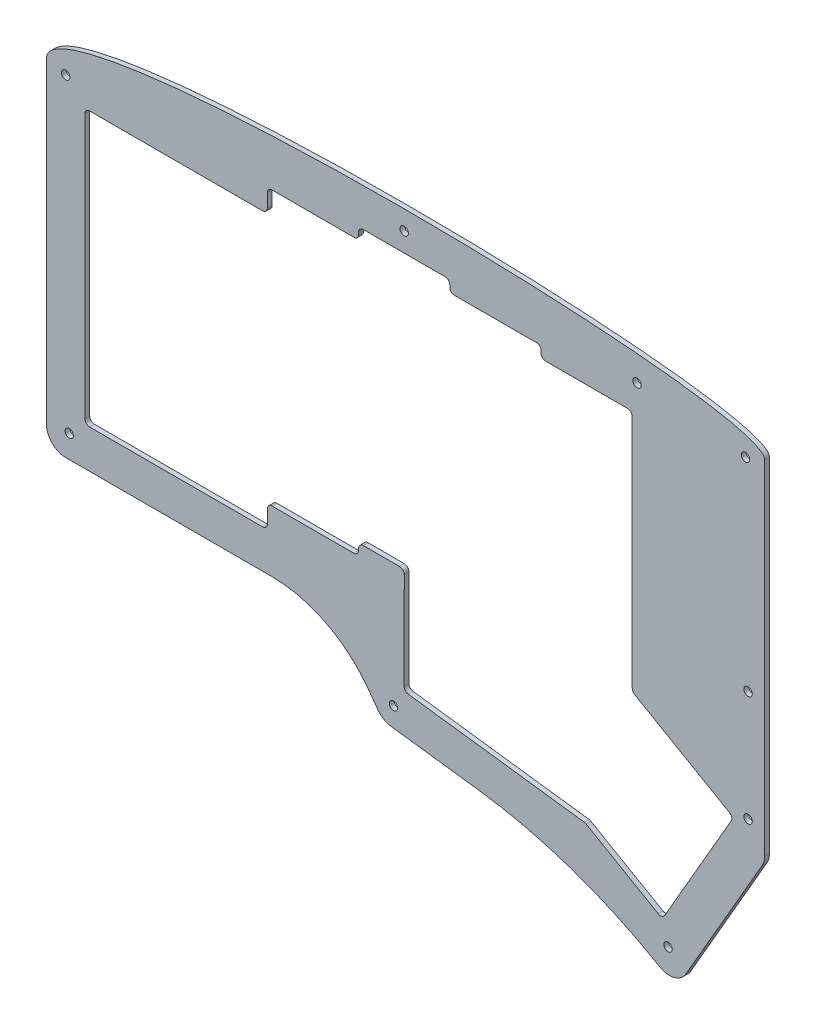
from build123d import *

# Parameters (mm, degrees)
SKETCH2_R           = 0.875
BOSS_EXTRUDE1_DEPTH = 1


with BuildPart() as part:
    # Sketch2 → Boss-Extrude1 (new body)
    with BuildSketch(Plane.XY):
        with BuildLine():
            Line((-5.603408365, 96.42556159), (-5.603408365, 30.425568858))
            ThreePointArc((-5.603408365, 30.425568858), (-4.43183549, 27.597141733), (-1.603408365, 26.425568858))
            Line((-1.603408365, 26.425568858), (41.250894393, 26.425568858))
            ThreePointArc((41.250894393, 26.425568858), (52.580802046, 23.710837368), (61.450097132, 16.156224264))
            Line((61.450097132, 16.156224264), (63.436905361, 13.431841599))
            ThreePointArc((63.436905361, 13.431841599), (64.629324911, 12.347724535), (66.15279536, 11.822165805))
            Line((66.15279536, 11.822165805), (84.159730921, 9.479779923))
            ThreePointArc((84.159730921, 9.479779923), (103.351530482, 5.02611066), (121.297670701, -3.103858071))
            Line((121.297670701, -3.103858071), (122.126093986, -3.582626958))
            ThreePointArc((122.126093986, -3.582626958), (125.162033535, -3.98331921), (127.591695632, -2.119391819))
            Line((127.591695632, -2.119391819), (143.453487011, 25.354036748))
            ThreePointArc((143.453487011, 25.354036748), (143.853088701, 26.318760568), (143.989385396, 27.354036748))
            Line((143.989385396, 27.354036748), (143.989385396, 98.790469349))
            add(Edge.make_bspline(
                [(-5.603408365, 96.42556159), (-5.603408365, 103.460733083), (68.627157279, 109.640132521), (143.989385396, 103.458567417), (143.989385396, 98.790469349)],
                knots=[0, 0, 0, 0, 0.499912399, 1, 1, 1, 1], degree=3))
        make_face()
        with Locations((123.859596668, 0.88165491)):
            Circle(SKETCH2_R, mode=Mode.SUBTRACT)
        with Locations((140.524945013, 32.281066453)):
            Circle(SKETCH2_R, mode=Mode.SUBTRACT)
        with Locations((140.524945013, 55.281066453)):
            Circle(SKETCH2_R, mode=Mode.SUBTRACT)
        with Locations((139.989385396, 97.290469349)):
            Circle(SKETCH2_R, mode=Mode.SUBTRACT)
        with Locations((117.399952063, 99.390469349)):
            Circle(SKETCH2_R, mode=Mode.SUBTRACT)
        with Locations((68.896968427, 102.54989148)):
            Circle(SKETCH2_R, mode=Mode.SUBTRACT)
        with Locations((-1.603408365, 95.42556159)):
            Circle(SKETCH2_R, mode=Mode.SUBTRACT)
        with Locations((-0.871175318, 31.157801905)):
            Circle(SKETCH2_R, mode=Mode.SUBTRACT)
        with Locations((66.6687778, 15.788746464)):
            Circle(SKETCH2_R, mode=Mode.SUBTRACT)
        with BuildLine():
            Line((2.396591635, 90.463437274), (2.396591635, 35.425568858))
            ThreePointArc((2.396591635, 35.425568858), (2.689484854, 34.718462076), (3.396591635, 34.425568858))
            Line((3.396591635, 34.425568858), (39.394762972, 34.425568858))
            ThreePointArc((39.394762972, 34.425568858), (40.101869753, 34.718462076), (40.394762972, 35.425568858))
            Line((40.394762972, 35.425568858), (40.394762972, 38.171054802))
            ThreePointArc((40.394762972, 38.171054802), (40.687656191, 38.878161583), (41.394762972, 39.171054802))
            Line((41.394762972, 39.171054802), (58.395031929, 39.171054802))
            ThreePointArc((58.395031929, 39.171054802), (59.10213871, 39.463948021), (59.395031929, 40.171054802))
            Line((59.395031929, 40.171054802), (59.395031929, 40.549898748))
            ThreePointArc((59.395031929, 40.549898748), (59.687925148, 41.257005529), (60.395031929, 41.549898748))
            Line((60.395031929, 41.549898748), (67.915303846, 41.549898748))
            ThreePointArc((67.915303846, 41.549898748), (68.622863481, 41.256552384), (68.915303025, 40.548617472))
            Line((68.915303025, 40.548617472), (68.889503983, 20.413194101))
            ThreePointArc((68.889503983, 20.413194101), (69.137749853, 19.75246839), (69.760507552, 19.420267661))
            Line((69.760507552, 19.420267661), (106.406539112, 14.653262932))
            ThreePointArc((106.406539112, 14.653262932), (106.598457108, 14.608726239), (106.77791851, 14.527426552))
            Line((106.77791851, 14.527426552), (121.798174914, 5.846802094))
            ThreePointArc((121.798174914, 5.846802094), (122.557159801, 5.746629031), (123.164575325, 6.212610879))
            Line((123.164575325, 6.212610879), (136.560419931, 29.414894346))
            Line((136.560419931, 29.414894346), (136.998243059, 30.153322469))
            ThreePointArc((136.998243059, 30.153322469), (137.105460539, 30.916626107), (136.637925468, 31.529438468))
            Line((136.637925468, 31.529438468), (116.900098761, 42.920620776))
            ThreePointArc((116.900098761, 42.920620776), (116.533969008, 43.286657516), (116.399952063, 43.78673086))
            Line((116.399952063, 43.78673086), (116.399952063, 92.828345033))
            ThreePointArc((116.399952063, 92.828345033), (116.118152375, 93.508669661), (115.437827746, 93.790469349))
            Line((115.437827746, 93.790469349), (98.360317754, 93.790469349))
            ThreePointArc((98.360317754, 93.790469349), (97.679993126, 94.072269037), (97.398193438, 94.752593666))
            Line((97.398193438, 94.752593666), (97.398193438, 95.213192117))
            ThreePointArc((97.398193438, 95.213192117), (97.11639375, 95.893516746), (96.436069121, 96.175316434))
            Line((96.436069121, 96.175316434), (79.359092742, 96.175316434))
            ThreePointArc((79.359092742, 96.175316434), (78.678768113, 96.457116122), (78.396968425, 97.137440751))
            Line((78.396968425, 97.137440751), (78.396968425, 97.587767164))
            ThreePointArc((78.396968425, 97.587767164), (78.115168737, 98.268091793), (77.434844109, 98.54989148))
            Line((77.434844109, 98.54989148), (60.359092745, 98.54989148))
            ThreePointArc((60.359092745, 98.54989148), (59.678768117, 98.268091793), (59.396968429, 97.587767164))
            Line((59.396968429, 97.587767164), (59.396968429, 97.133171852))
            ThreePointArc((59.396968429, 97.133171852), (59.115168741, 96.452847223), (58.434844112, 96.171047535))
            Line((58.434844112, 96.171047535), (41.357156249, 96.171047535))
            ThreePointArc((41.357156249, 96.171047535), (40.676831621, 95.889247847), (40.395031933, 95.208923218))
            Line((40.395031933, 95.208923218), (40.395031933, 92.387685907))
            ThreePointArc((40.395031933, 92.387685907), (40.113232245, 91.707361278), (39.432907616, 91.42556159))
            Line((39.432907616, 91.42556159), (3.358715952, 91.42556159))
            ThreePointArc((3.358715952, 91.42556159), (2.678391323, 91.143761902), (2.396591635, 90.463437274))
        make_face(mode=Mode.SUBTRACT)
    extrude(amount=BOSS_EXTRUDE1_DEPTH)


solid = part.part
